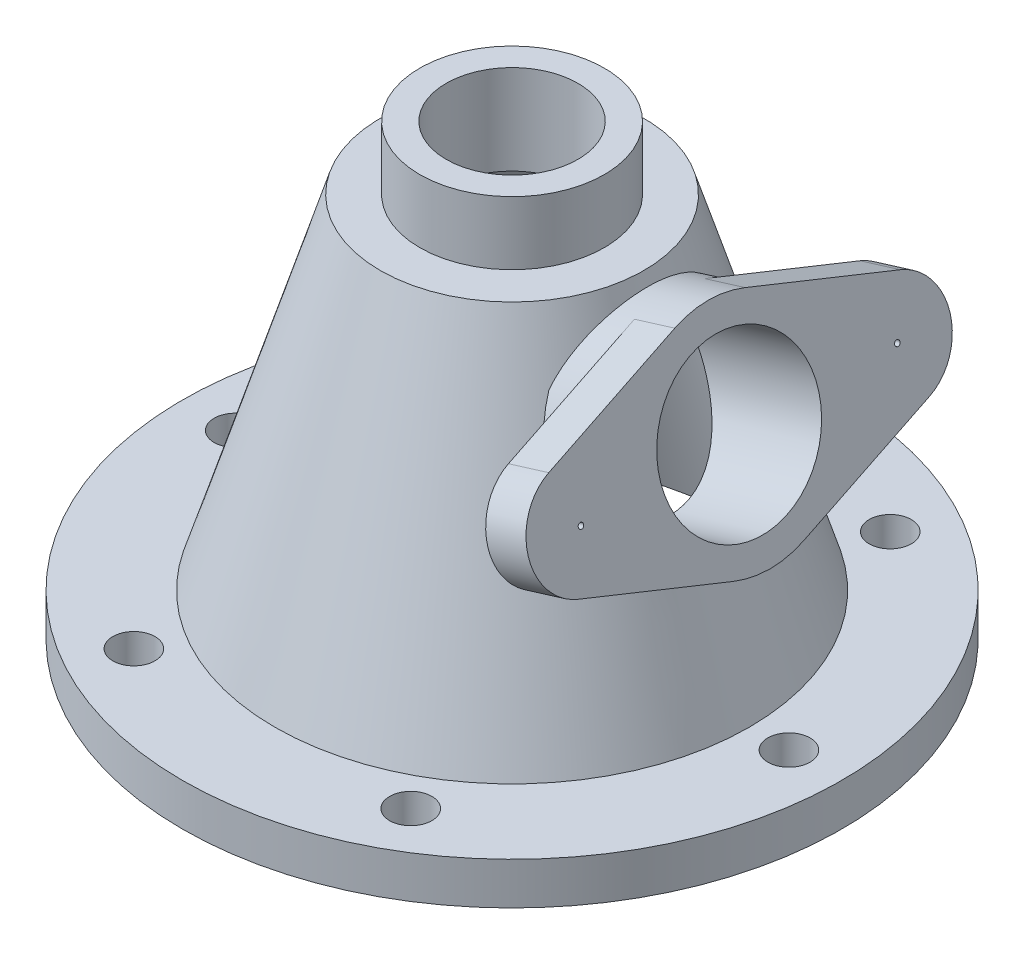
from build123d import *

# Parameters (mm, degrees)
SKETCH_1_R           = 62.5
SKETCH_1_R_2         = 45
EXTRUDE_2_DEPTH      = 8
SKETCH_3_R           = 4
CUT_EXTRUDE_1_DEPTH  = 8
EXTRUDE_3_DEPTH      = 12
EXTRUDE_3_DEPTH_BACK = 5
SKETCH_8_R           = 20
SKETCH_9_R           = 0.5
EXTRUDE_4_DEPTH      = 8
SKETCH_10_R          = 15
CUT_EXTRUDE_2_DEPTH  = 25


with BuildPart() as part:
    # 草图1 → 凸台-拉伸2 (new body)
    with BuildSketch(Plane(origin=(0, 0, 0), x_dir=(1, 0, 0), z_dir=(0, 1, 0))):
        with Locations(Location((0, 0, 0), (0, 0, 270))):
            Circle(SKETCH_1_R)
        with Locations(Location((0, 0, 0), (0, 0, 270))):
            Circle(SKETCH_1_R_2, mode=Mode.SUBTRACT)
    extrude(amount=EXTRUDE_2_DEPTH)

    # 草图3 → 切除-拉伸1 (cut)
    with BuildSketch(Plane(origin=(0, 0, 0), x_dir=(1, 0, 0), z_dir=(0, 1, 0))):
        with Locations(Location((-52.5, 0, 0), (0, 0, 270))):
            Circle(SKETCH_3_R)
        with Locations(Location((-26.25, 45.466334, 0), (0, 0, 270))):
            Circle(SKETCH_3_R)
        with Locations(Location((26.25, 45.466334, 0), (0, 0, 270))):
            Circle(SKETCH_3_R)
        with Locations(Location((52.5, 0, 0), (0, 0, 270))):
            Circle(SKETCH_3_R)
        with Locations(Location((26.25, -45.466334, 0), (0, 0, 270))):
            Circle(SKETCH_3_R)
        with Locations(Location((-26.25, -45.466334, 0), (0, 0, 270))):
            Circle(SKETCH_3_R)
    extrude(amount=CUT_EXTRUDE_1_DEPTH, mode=Mode.SUBTRACT)

    # 草图7 → 旋转5 (revolve)
    with BuildSketch(Plane.XY, mode=Mode.PRIVATE) as revolve_5_sk:
        Polygon((-12.5, 85), (-17.5, 85), (-17.5, 73), (-25, 73), (-47.461538, 0), (-40.923077, 0), (-20, 68), (-12.5, 68), (-12.5, 73), align=None)
    revolve(revolve_5_sk.sketch.rotate(Axis((0, 89.25, 0), (0, -1, 0)), 270), axis=Axis((0, 89.25, 0), (0, -1, 0)))

    # 草图8 → 凸台-拉伸3 (add, two sides: drawn at the far end of the back side and taken through both)
    with BuildSketch(Plane(origin=(43.356757, 13.340541, 0), x_dir=(0, 0, -1), z_dir=(0.9557790087219498, 0.29408584883752426, 0)).offset(-EXTRUDE_3_DEPTH_BACK)):
        with Locations(Location((0, 40, 0), (0, 0, 90))):
            Circle(SKETCH_8_R)
    extrude(amount=EXTRUDE_3_DEPTH + EXTRUDE_3_DEPTH_BACK)

    # 草图9 → 凸台-拉伸4 (add)
    with BuildSketch(Plane(origin=(54.826105, 16.869571, 0), x_dir=(0, 0, -1), z_dir=(0.9557790087219498, 0.29408584883752426, 0))):
        with BuildLine():
            Line((-33.333333, 49.42809), (-6.666667, 58.856181))
            ThreePointArc((-6.666667, 58.856181), (0, 60), (6.666667, 58.856181))
            Line((6.666667, 58.856181), (33.333333, 49.42809))
            ThreePointArc((33.333333, 49.42809), (40, 40), (33.333333, 30.57191))
            Line((33.333333, 30.57191), (6.666667, 21.143819))
            ThreePointArc((6.666667, 21.143819), (0, 20), (-6.666667, 21.143819))
            Line((-6.666667, 21.143819), (-33.333333, 30.57191))
            ThreePointArc((-33.333333, 30.57191), (-40, 40), (-33.333333, 49.42809))
        make_face()
        with Locations(Location((-30, 40, 0), (0, 0, 90))):
            Circle(SKETCH_9_R, mode=Mode.SUBTRACT)
        with Locations(Location((30, 40, 0), (0, 0, 90))):
            Circle(SKETCH_9_R, mode=Mode.SUBTRACT)
    extrude(amount=-EXTRUDE_4_DEPTH)

    # 草图10 → 切除-拉伸2 (cut)
    with BuildSketch(Plane(origin=(54.826105, 16.869571, 0), x_dir=(0, 0, -1), z_dir=(0.9557790087219498, 0.29408584883752426, 0))):
        with Locations(Location((0, 40, 0), (0, 0, 90))):
            Circle(SKETCH_10_R)
    extrude(amount=-CUT_EXTRUDE_2_DEPTH, mode=Mode.SUBTRACT)


solid = part.part
